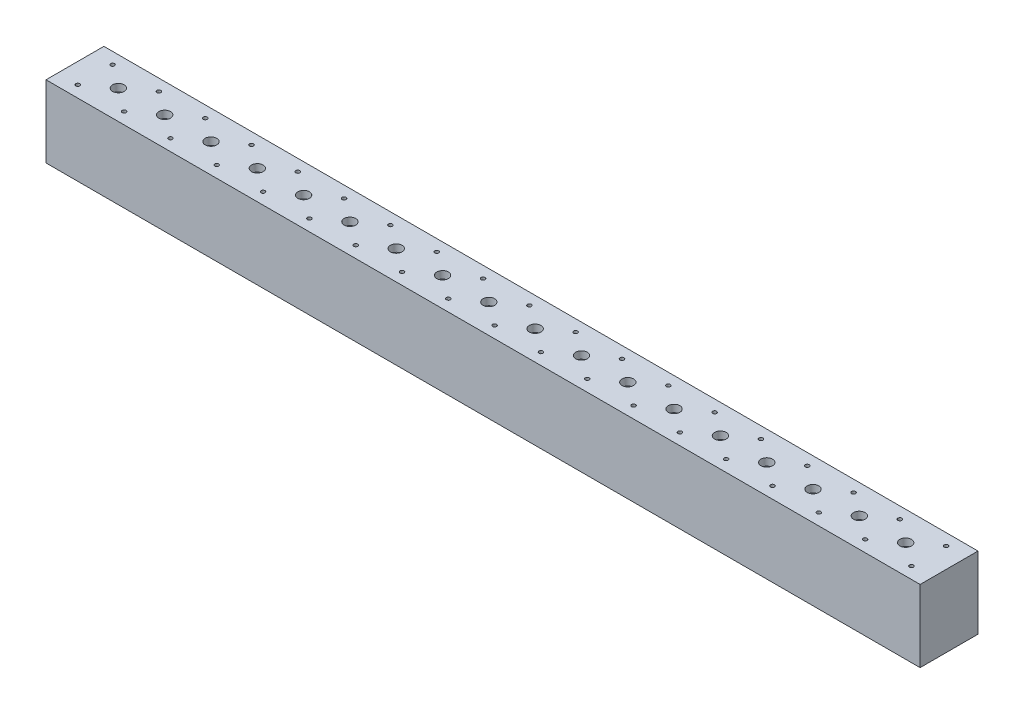
from build123d import *

# Parameters (mm, degrees)
SKETCH1_W                                            = 1510
SKETCH1_H                                            = 124.5
BOSS_EXTRUDE1_DEPTH                                  = 100
M8_TAPPED_HOLE1_D                                    = 6.8
M8_TAPPED_HOLE1_DEPTH                                = 22.25
M8_TAPPED_HOLE1_TIP                                  = 2.042926105
CBORE_FOR_M12_HEX_SOCKET_HEAD_CAP_SCREW1_D           = 13
CBORE_FOR_M12_HEX_SOCKET_HEAD_CAP_SCREW1_CBORE_D     = 20
CBORE_FOR_M12_HEX_SOCKET_HEAD_CAP_SCREW1_CBORE_DEPTH = 12.6
LPATTERN1_COUNT                                      = 18
LPATTERN1_PITCH                                      = 80


with BuildPart() as part:
    # Sketch1 → Boss-Extrude1 (new body)
    with BuildSketch(Plane.XY):
        with Locations((0, 77.25)):
            Rectangle(SKETCH1_W, SKETCH1_H)
    extrude(amount=-BOSS_EXTRUDE1_DEPTH)

    # M8 Tapped Hole1
    with Locations(Plane(origin=(0, 139.5, 0), x_dir=(1, 0, 0), z_dir=(0, 1, 0))):
        with Locations((720, 80), (720, 20), (640, 20), (640, 80), (560, 80), (560, 20), (480, 20), (480, 80), (400, 80), (400, 20), (320, 20), (320, 80), (240, 80), (240, 20), (160, 20), (160, 80), (80, 80), (80, 20), (0, 20), (0, 80), (-80, 80), (-80, 20), (-160, 20), (-160, 80), (-240, 80), (-240, 20), (-320, 20), (-320, 80), (-400, 80), (-400, 20), (-480, 20), (-480, 80), (-560, 20), (-560, 80), (-640, 20), (-640, 80), (-720, 80), (-720, 20)):
            Hole(M8_TAPPED_HOLE1_D / 2, depth=M8_TAPPED_HOLE1_DEPTH)
            with Locations((0, 0, -(M8_TAPPED_HOLE1_DEPTH + M8_TAPPED_HOLE1_TIP / 2))):  # 118° drill point
                Cone(0, M8_TAPPED_HOLE1_D / 2, M8_TAPPED_HOLE1_TIP, mode=Mode.SUBTRACT)

    # CBORE for M12 Hex Socket Head Cap Screw1 (through all)
    with Locations(Plane(origin=(0, 139.5, 0), x_dir=(1, 0, 0), z_dir=(0, 1, 0))):
        with Locations((680, 50)):
            cbore_for_m12_hex_socket_head_cap_screw1 = CounterBoreHole(CBORE_FOR_M12_HEX_SOCKET_HEAD_CAP_SCREW1_D / 2, CBORE_FOR_M12_HEX_SOCKET_HEAD_CAP_SCREW1_CBORE_D / 2, CBORE_FOR_M12_HEX_SOCKET_HEAD_CAP_SCREW1_CBORE_DEPTH)

    # LPattern1: CBORE for M12 Hex Socket Head Cap Screw1 ×18
    with Locations(*[(-i * LPATTERN1_PITCH, 0, 0) for i in range(1, LPATTERN1_COUNT)]):
        add(cbore_for_m12_hex_socket_head_cap_screw1, mode=Mode.SUBTRACT)


solid = part.part
